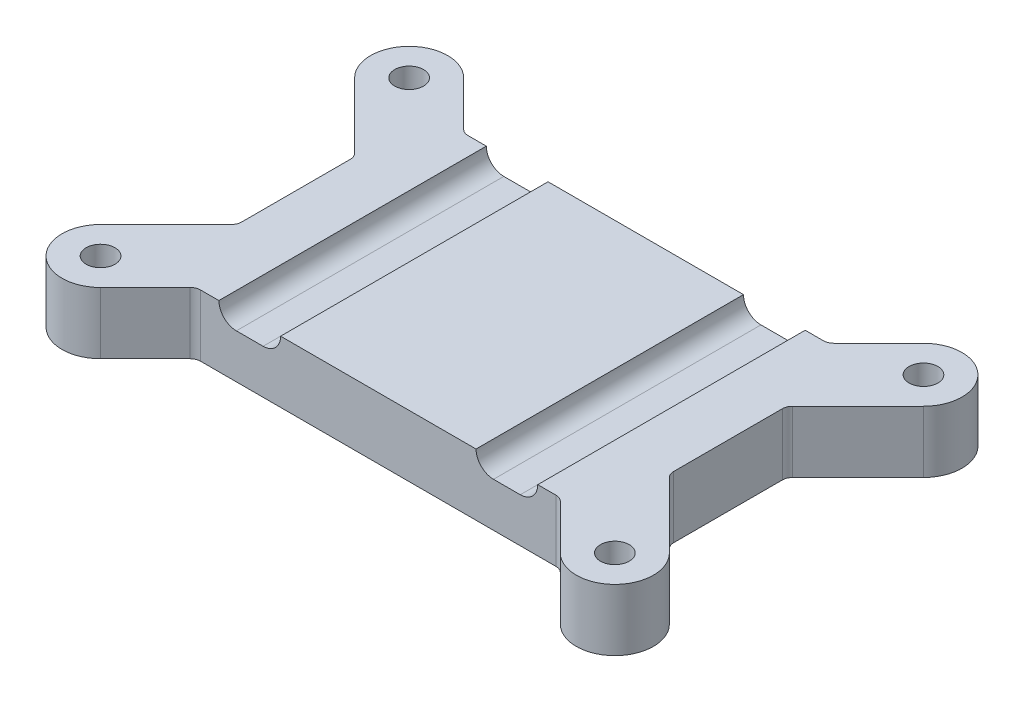
from build123d import *

# Parameters (mm, degrees)
SKETCH1_R                 = 1.4
BASE_DEPTH                = 6
WIRE_GROOVES_DEPTH        = 44.250722537
F_1MM_SIDE_EDGE_FILLETS_R = 1


with BuildPart() as part:
    # Sketch1 → Base (new body)
    with BuildSketch(Plane(origin=(0, 0, 0), x_dir=(1, 0, 0), z_dir=(0, 1, 0))):
        with BuildLine():
            Line((-17.696699141, 13), (17.696699141, 13))
            Line((17.696699141, 13), (22.348349571, 17.651650429))
            ThreePointArc((22.348349571, 17.651650429), (27.651650429, 17.651650429), (27.651650429, 12.348349571))
            Line((27.651650429, 12.348349571), (21, 5.696699141))
            Line((21, 5.696699141), (21, -5.696699141))
            Line((21, -5.696699141), (27.651650429, -12.348349571))
            ThreePointArc((27.651650429, -12.348349571), (27.651650429, -17.651650429), (22.348349571, -17.651650429))
            Line((22.348349571, -17.651650429), (17.696699141, -13))
            Line((17.696699141, -13), (-17.696699141, -13))
            Line((-17.696699141, -13), (-22.348349571, -17.651650429))
            ThreePointArc((-22.348349571, -17.651650429), (-27.651650429, -17.651650429), (-27.651650429, -12.348349571))
            Line((-27.651650429, -12.348349571), (-21, -5.696699141))
            Line((-21, -5.696699141), (-21, 5.696699141))
            Line((-21, 5.696699141), (-27.651650429, 12.348349571))
            ThreePointArc((-27.651650429, 12.348349571), (-27.651650429, 17.651650429), (-22.348349571, 17.651650429))
            Line((-22.348349571, 17.651650429), (-17.696699141, 13))
        make_face()
        with Locations((-25, 15)):
            Circle(SKETCH1_R, mode=Mode.SUBTRACT)
        with Locations((-25, -15)):
            Circle(SKETCH1_R, mode=Mode.SUBTRACT)
        with Locations((25, -15)):
            Circle(SKETCH1_R, mode=Mode.SUBTRACT)
        with Locations((25, 15)):
            Circle(SKETCH1_R, mode=Mode.SUBTRACT)
    extrude(amount=BASE_DEPTH)

    # Sketch2 → Wire Grooves (cut, through all)
    with BuildSketch(Plane.XY.offset(13)):
        with BuildLine():
            Line((-15.496699141, 6), (-9.496699141, 6))
            ThreePointArc((-9.496699141, 6), (-9.994617613, 4.797918472), (-11.196699141, 4.3))
            Line((-11.196699141, 4.3), (-13.796699141, 4.3))
            ThreePointArc((-13.796699141, 4.3), (-14.998780669, 4.797918472), (-15.496699141, 6))
        make_face()
        with BuildLine():
            Line((9.503300859, 6), (15.503300859, 6))
            ThreePointArc((15.503300859, 6), (15.005382387, 4.797918472), (13.803300859, 4.3))
            Line((13.803300859, 4.3), (11.203300859, 4.3))
            ThreePointArc((11.203300859, 4.3), (10.001219331, 4.797918472), (9.503300859, 6))
        make_face()
    extrude(amount=-WIRE_GROOVES_DEPTH, mode=Mode.SUBTRACT)

    # 1mm Side Edge Fillets
    f_1mm_side_edge_fillets_edges = [part.edges().sort_by_distance(p)[0] for p in [
        (-21, 3, 5.696699141),
        (-17.696699141, 3, -13),
        (17.696699141, 3, -13),
        (21, 3, -5.696699141),
        (21, 3, 5.696699141),
        (17.696699141, 3, 13),
        (-17.696699141, 3, 13),
        (-21, 3, -5.696699141),
    ]]
    fillet(f_1mm_side_edge_fillets_edges, radius=F_1MM_SIDE_EDGE_FILLETS_R)


solid = part.part
